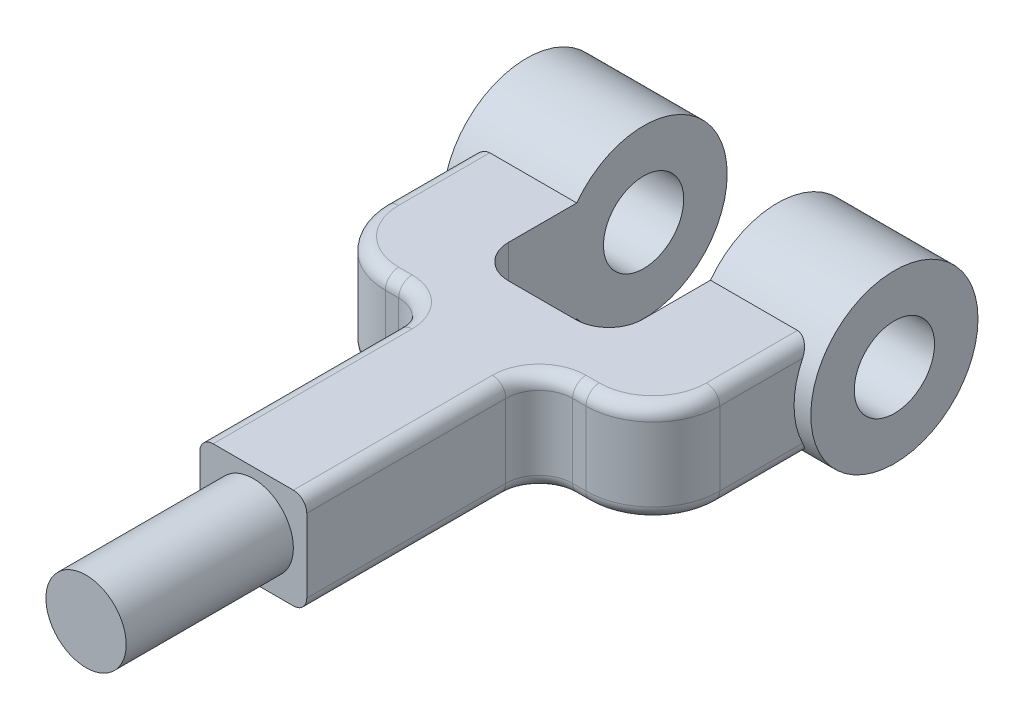
from build123d import *

# Parameters (mm, degrees)
BOSS_EXTRUDE1_DEPTH     = 7.5
SKETCH2_R               = 12.5
SKETCH2_R_2             = 6
BOSS_EXTRUDE2_DEPTH     = 27.5
CUT_EXTRUDE1_DEPTH      = 56.021489892
CUT_EXTRUDE1_DEPTH_BACK = 56.021489892
SKETCH2_3_R             = 6
CUT_EXTRUDE2_DEPTH      = 56.021489892
CUT_EXTRUDE2_DEPTH_BACK = 56.021489892
SKETCH3_W               = 20
SKETCH3_H               = 27.591963828
FILLET1_R               = 2
SKETCH4_R               = 6
BOSS_EXTRUDE3_DEPTH     = 25


with BuildPart() as part:
    # Sketch1 → Boss-Extrude1 (new, symmetric)
    with BuildSketch(Plane(origin=(0, 0, 0), x_dir=(1, 0, 0), z_dir=(0, 1, 0))):
        with BuildLine():
            Line((13, -11.237079071), (15, -11.237079071))
            ThreePointArc((15, -11.237079071), (22.071067812, -8.308146883), (25, -1.237079071))
            Line((25, -1.237079071), (25, 2.345679012))
            Line((25, 2.345679012), (25, 30))
            Line((25, 30), (10, 30))
            Line((10, 30), (10, 2.190396801))
            ThreePointArc((10, 2.190396801), (8.535533906, -1.345137105), (5, -2.809603199))
            Line((5, -2.809603199), (-5, -2.809603199))
            ThreePointArc((-5, -2.809603199), (-8.535533906, -1.345137105), (-10, 2.190396801))
            Line((-10, 2.190396801), (-10, 30))
            Line((-10, 30), (-25, 30))
            Line((-25, 30), (-25, 2.345679012))
            Line((-25, 2.345679012), (-25, -1.237079071))
            ThreePointArc((-25, -1.237079071), (-22.071067812, -8.308146883), (-15, -11.237079071))
            Line((-15, -11.237079071), (-13, -11.237079071))
            ThreePointArc((-13, -11.237079071), (-9.464466094, -12.701545165), (-8, -16.237079071))
            Line((-8, -16.237079071), (-8, -45.987654321))
            Line((-8, -45.987654321), (8, -45.987654321))
            Line((8, -45.987654321), (8, -16.237079071))
            ThreePointArc((8, -16.237079071), (9.464466094, -12.701545165), (13, -11.237079071))
        make_face()
    extrude(amount=BOSS_EXTRUDE1_DEPTH, both=True)

    # Sketch2 → Boss-Extrude2 (add, symmetric)
    with BuildSketch(Plane(origin=(0, 0, 0), x_dir=(0, 0, -1), z_dir=(1, 0, 0))):
        with Locations((22.374324457, 0)):
            Circle(SKETCH2_R)
        with Locations((22.374324457, 0)):
            Circle(SKETCH2_R_2, mode=Mode.SUBTRACT)
    extrude(amount=BOSS_EXTRUDE2_DEPTH, both=True)

    # Sketch2<3> → Cut-Extrude1 (cut, two sides: drawn at the far end of the back side and taken through both)
    with BuildSketch(Plane(origin=(0, 0, 0), x_dir=(0, 0, -1), z_dir=(1, 0, 0)).offset(-CUT_EXTRUDE1_DEPTH_BACK)):
        with Locations((22.374324457, 0)):
            Circle(SKETCH2_3_R)
    extrude(amount=CUT_EXTRUDE1_DEPTH + CUT_EXTRUDE1_DEPTH_BACK, mode=Mode.SUBTRACT)

    # Sketch3 → Cut-Extrude2 (cut, two sides: drawn at the far end of the back side and taken through both)
    with BuildSketch(Plane(origin=(0, 0, 0), x_dir=(1, 0, 0), z_dir=(0, 1, 0)).offset(-CUT_EXTRUDE2_DEPTH_BACK)):
        with Locations((0, 21.078342543)):
            Rectangle(SKETCH3_W, SKETCH3_H)
    extrude(amount=CUT_EXTRUDE2_DEPTH + CUT_EXTRUDE2_DEPTH_BACK, mode=Mode.SUBTRACT)

    # Fillet1
    fillet1_edges = [part.edges().sort_by_distance(p)[0] for p in [
        (-25, -7.5, -5.568622693),
        (-8, -7.5, 31.112366696),
        (-9.464466094, -7.5, 12.701545165),
        (-14, -7.5, 11.237079071),
        (8, -7.5, 31.112366696),
        (9.464466094, -7.5, 12.701545165),
        (14, -7.5, 11.237079071),
        (25, -7.5, -5.568622693),
        (-25, 7.5, -5.568622693),
        (-8, 7.5, 31.112366696),
        (-9.464466094, 7.5, 12.701545165),
        (-14, 7.5, 11.237079071),
        (8, 7.5, 31.112366696),
        (9.464466094, 7.5, 12.701545165),
        (14, 7.5, 11.237079071),
        (25, 7.5, -5.568622693),
        (-22.071067812, -7.5, 8.308146883),
        (22.071067812, -7.5, 8.308146883),
        (-22.071067812, 7.5, 8.308146883),
        (22.071067812, 7.5, 8.308146883),
    ]]
    fillet(fillet1_edges, radius=FILLET1_R)

    # Sketch4 → Boss-Extrude3 (add)
    with BuildSketch(Plane.XY.offset(45.987654321)):
        Circle(SKETCH4_R)
    extrude(amount=BOSS_EXTRUDE3_DEPTH)


solid = part.part
